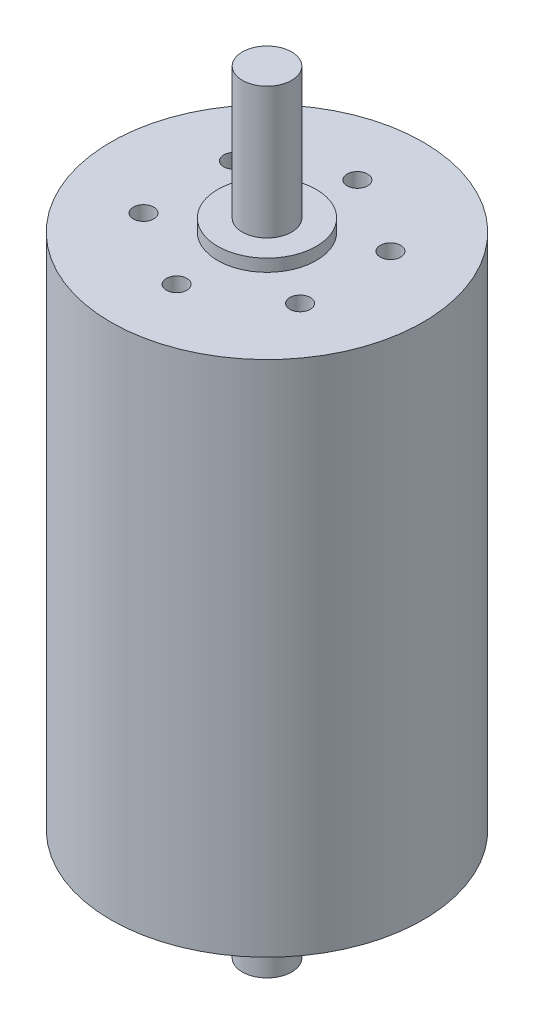
from build123d import *

# Parameters (mm, degrees)
ESQUISSE2_R             = 1.25
ENL_V_MAT_EXTRU_1_DEPTH = 5
ENL_V_START             = -58
ESQUISSE2_2_R           = 1.25
ENL_V_MAT_EXTRU_2_DEPTH = 5


with BuildPart() as part:
    # Esquisse1 → Révolution1 (revolve)
    with BuildSketch(Plane.XY, mode=Mode.PRIVATE) as r_volution1_sk:
        Polygon((0, 0), (0, 94), (3, 94), (3, 78), (6, 78), (6, 76.5), (19, 76.5), (19, 13.5), (6, 13.5), (6, 12), (3, 12), (3, 0), align=None)
    revolve(r_volution1_sk.sketch.rotate(Axis((0, 0, 0), (0, 1, 0)), 90), axis=Axis((0, 0, 0), (0, 1, 0)))

    # Esquisse2 → Enlèv. mat.-Extru.1 (cut)
    with BuildSketch(Plane(origin=(0, 76.5, 0), x_dir=(1, 0, 0), z_dir=(0, 1, 0))):
        with Locations(Location((0, 11, 0), (0, 0, 270))):
            Circle(ESQUISSE2_R)
        with Locations(Location((9.526279442, 5.5, 0), (0, 0, 270))):
            Circle(ESQUISSE2_R)
        with Locations(Location((9.526279442, -5.5, 0), (0, 0, 270))):
            Circle(ESQUISSE2_R)
        with Locations(Location((0, -11, 0), (0, 0, 270))):
            Circle(ESQUISSE2_R)
        with Locations(Location((-9.526279442, -5.5, 0), (0, 0, 270))):
            Circle(ESQUISSE2_R)
        with Locations(Location((-9.526279442, 5.5, 0), (0, 0, 270))):
            Circle(ESQUISSE2_R)
    extrude(amount=-ENL_V_MAT_EXTRU_1_DEPTH, mode=Mode.SUBTRACT)

    # Esquisse2<2> → Enlèv. mat.-Extru.2 (cut)
    with BuildSketch(Plane(origin=(0, 76.5, 0), x_dir=(1, 0, 0), z_dir=(0, 1, 0)).offset(ENL_V_START)):
        with Locations(Location((0, 11, 0), (0, 0, 270))):
            Circle(ESQUISSE2_2_R)
        with Locations(Location((9.526279442, 5.5, 0), (0, 0, 270))):
            Circle(ESQUISSE2_2_R)
        with Locations(Location((9.526279442, -5.5, 0), (0, 0, 270))):
            Circle(ESQUISSE2_2_R)
        with Locations(Location((0, -11, 0), (0, 0, 270))):
            Circle(ESQUISSE2_2_R)
        with Locations(Location((-9.526279442, -5.5, 0), (0, 0, 270))):
            Circle(ESQUISSE2_2_R)
        with Locations(Location((-9.526279442, 5.5, 0), (0, 0, 270))):
            Circle(ESQUISSE2_2_R)
    extrude(amount=-ENL_V_MAT_EXTRU_2_DEPTH, mode=Mode.SUBTRACT)


solid = part.part
